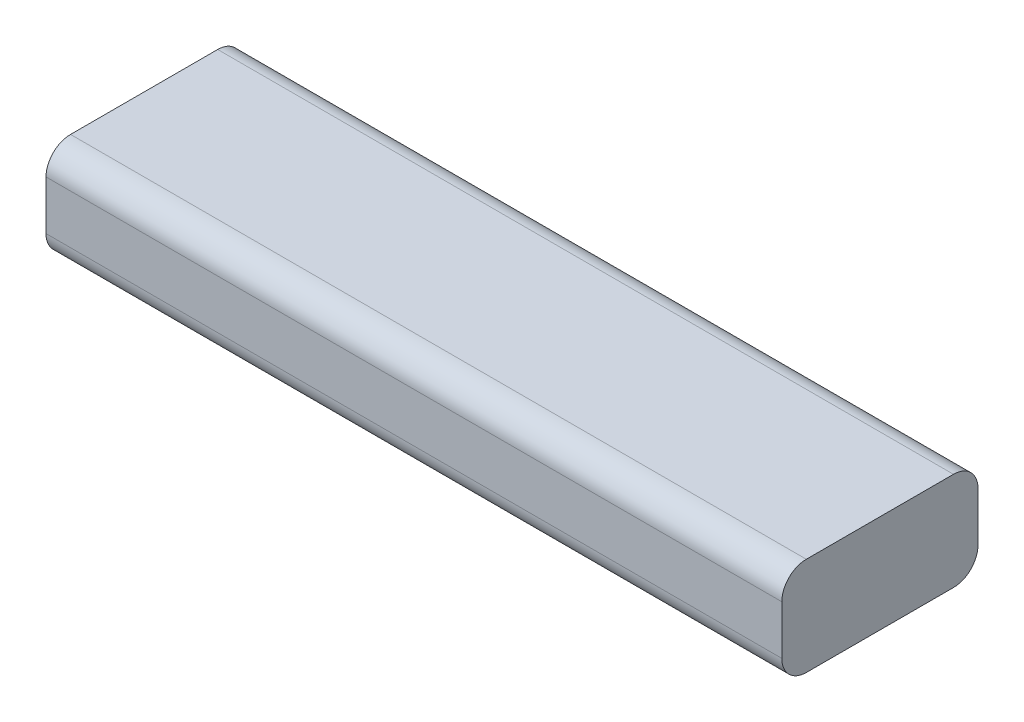
from build123d import *

# Parameters (mm, degrees)
SKETCH1_W           = 150
SKETCH1_H           = 40
BOSS_EXTRUDE1_DEPTH = 20
CUT_EXTRUDE1_START  = -1
SKETCH2_W           = 30
SKETCH2_H           = 30
CUT_EXTRUDE1_DEPTH  = 5
SKETCH7_R           = 2
CUT_EXTRUDE3_DEPTH  = 140
FILLET1_R           = 5
CUT_EXTRUDE5_START  = -25
SKETCH9_R           = 9
CUT_EXTRUDE5_DEPTH  = 50
SKETCH8_R           = 2
CUT_EXTRUDE4_DEPTH  = 62


with BuildPart() as part:
    # Sketch1 → Boss-Extrude1 (new body)
    with BuildSketch(Plane(origin=(0, 0, 0), x_dir=(1, 0, 0), z_dir=(0, 1, 0))):
        Rectangle(SKETCH1_W, SKETCH1_H)
    extrude(amount=BOSS_EXTRUDE1_DEPTH)

    # Sketch2 → Cut-Extrude1 (cut)
    with BuildSketch(Plane.XZ.offset(CUT_EXTRUDE1_START)):
        with Locations((55, 0)):
            Rectangle(SKETCH2_W, SKETCH2_H)
    extrude(amount=-CUT_EXTRUDE1_DEPTH, mode=Mode.SUBTRACT)

    # Sketch7 → Cut-Extrude3 (cut)
    with BuildSketch(Plane.ZY.offset(75)):
        with Locations((12, 3.5)):
            Circle(SKETCH7_R)
    extrude(amount=-CUT_EXTRUDE3_DEPTH, mode=Mode.SUBTRACT)

    # Fillet1
    fillet1_edges = [part.edges().sort_by_distance(p)[0] for p in [
        (0, 20, -20),
        (0, 0, -20),
        (0, 0, 20),
        (0, 20, 20),
    ]]
    fillet(fillet1_edges, radius=FILLET1_R)

    # Sketch9 → Cut-Extrude5 (cut)
    with BuildSketch(Plane.ZY.offset(75).offset(CUT_EXTRUDE5_START)):
        with Locations((0, 10)):
            Circle(SKETCH9_R)
    extrude(amount=-CUT_EXTRUDE5_DEPTH, mode=Mode.SUBTRACT)

    # Sketch8 → Cut-Extrude4 (cut)
    with BuildSketch(Plane.ZY.offset(75)):
        with Locations((0, 10)):
            Circle(SKETCH8_R)
    extrude(amount=-CUT_EXTRUDE4_DEPTH, mode=Mode.SUBTRACT)


solid = part.part
